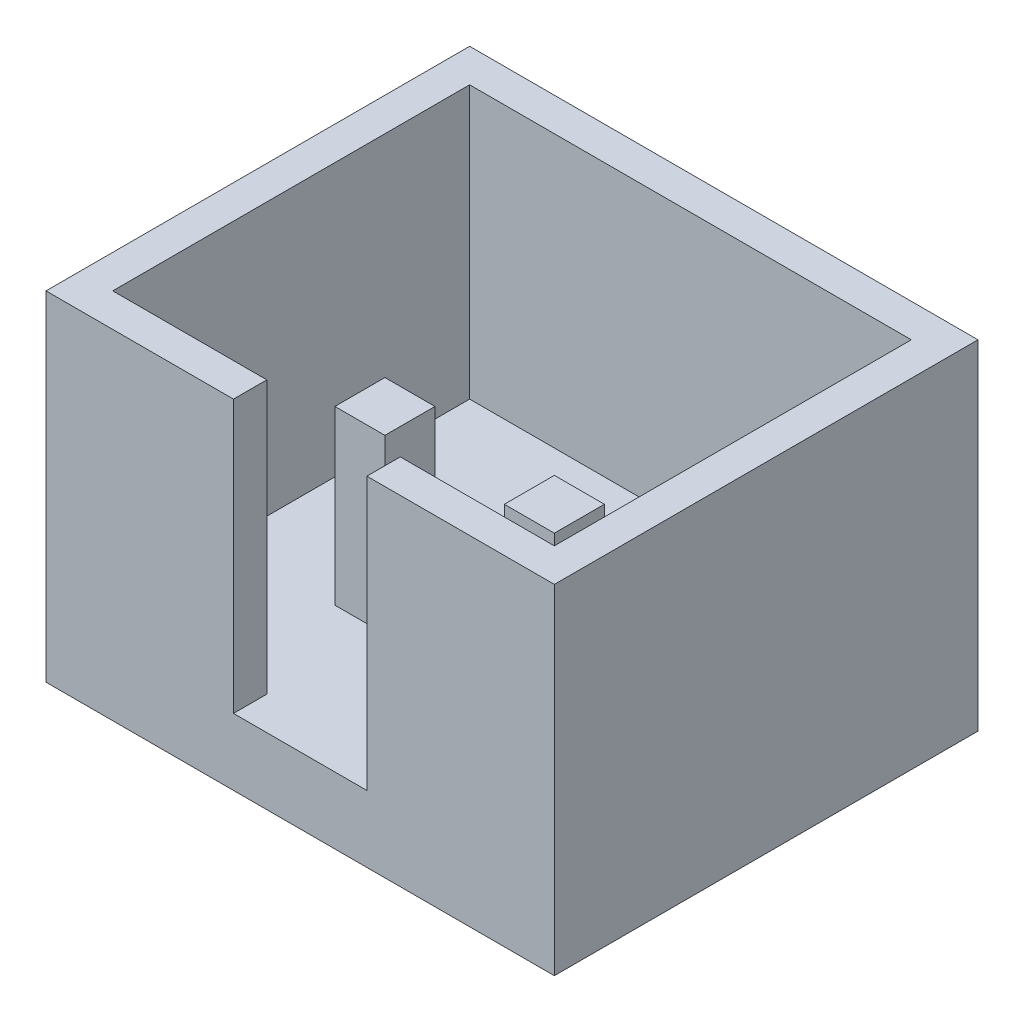
from build123d import *

# Parameters (mm, degrees)
SKETCH_1_W           = 7.62
SKETCH_1_H           = 6.35
EXTRUDE_1_DEPTH      = 5.08
SKETCH_2_W           = 6.62
SKETCH_2_H           = 5.35
CUT_EXTRUDE_1_DEPTH  = 4.08
SKETCH_3_W           = 2
SKETCH_3_H           = 4.08
CUT_EXTRUDE_2_DEPTH  = 1
EXTRUDE_2_DEPTH      = 2
EXTRUDE_2_DEPTH_BACK = 3.58
SKETCH_4_W           = 0.75
SKETCH_4_H           = 0.75


with BuildPart() as part:
    # 草图1 → 拉伸1 (new body)
    with BuildSketch(Plane(origin=(0, 0, 0), x_dir=(1, 0, 0), z_dir=(0, 1, 0))):
        Rectangle(SKETCH_1_W, SKETCH_1_H)
    extrude(amount=EXTRUDE_1_DEPTH)

    # 草图2 → 切除-拉伸1 (cut)
    with BuildSketch(Plane(origin=(0, 5.08, 0), x_dir=(-1, 0, 0), z_dir=(0, 1, 0))):
        Rectangle(SKETCH_2_W, SKETCH_2_H)
    extrude(amount=-CUT_EXTRUDE_1_DEPTH, mode=Mode.SUBTRACT)

    # 草图3 → 切除-拉伸2 (cut)
    with BuildSketch(Plane.XY.offset(3.175)):
        with Locations((0, 3.04)):
            Rectangle(SKETCH_3_W, SKETCH_3_H)
    extrude(amount=-CUT_EXTRUDE_2_DEPTH, mode=Mode.SUBTRACT)

    # 草图4 → 拉伸2 (add, two sides: drawn at the far end of the back side and taken through both)
    with BuildSketch(Plane.XZ.offset(-EXTRUDE_2_DEPTH_BACK)):
        with Locations((-1.27, 0.635)):
            Rectangle(SKETCH_4_W, SKETCH_4_H)
        with Locations((1.27, 0.635)):
            Rectangle(SKETCH_4_W, SKETCH_4_H)
    extrude(amount=EXTRUDE_2_DEPTH + EXTRUDE_2_DEPTH_BACK)


solid = part.part
